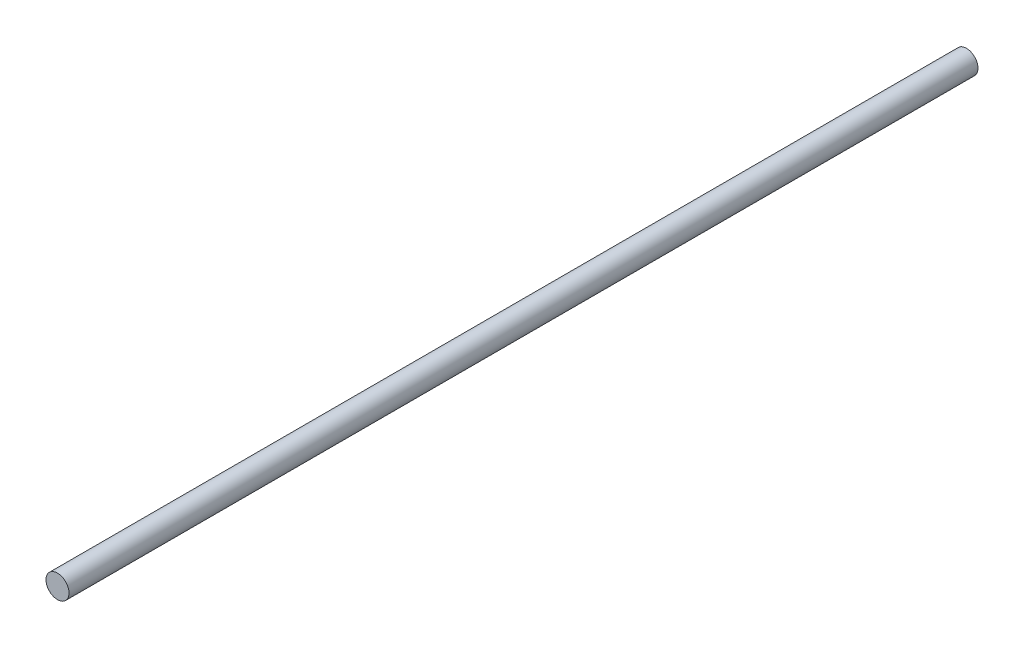
from build123d import *

# Parameters (mm, degrees)
CROQUIS1_R              = 4.5
SALIENTE_EXTRUIR1_DEPTH = 355


with BuildPart() as part:
    # Croquis1 → Saliente-Extruir1 (new body)
    with BuildSketch(Plane.XY):
        Circle(CROQUIS1_R)
    extrude(amount=SALIENTE_EXTRUIR1_DEPTH)


solid = part.part
